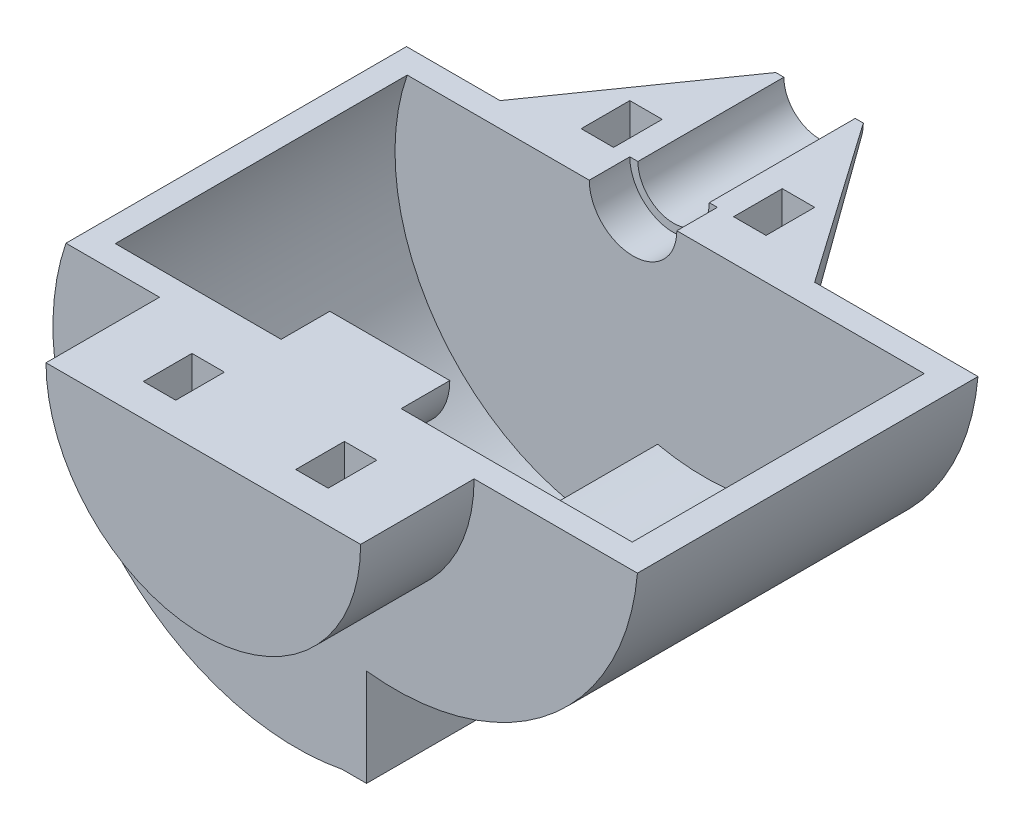
from build123d import *

# Parameters (mm, degrees)
SALIENTE_EXTRUIR1_DEPTH = 18
SALIENTE_EXTRUIR2_START = 1.5
CROQUIS2_R              = 2.7
SALIENTE_EXTRUIR2_DEPTH = 1.5
SALIENTE_EXTRUIR3_DEPTH = 1.5
CROQUIS6_W              = 5.4
CROQUIS6_H              = 1.803822617
SALIENTE_EXTRUIR7_DEPTH = 10
CROQUIS10_W             = 5.4
CROQUIS10_H             = 10
CORTAR_EXTRUIR3_DEPTH   = 10
CROQUIS12_W             = 50.345864286
CROQUIS12_H             = 43.398115734
CORTAR_EXTRUIR4_DEPTH   = 30
CROQUIS14_W             = 2
CROQUIS14_H             = 3
CORTAR_EXTRUIR5_DEPTH   = 30
CORTAR_EXTRUIR7_START   = -7.4
CROQUIS16_W             = 3
CROQUIS16_H             = 7.002646448
CROQUIS16_H_2           = 3.270183245
CORTAR_EXTRUIR7_DEPTH   = 7.4
CROQUIS17_W             = 3.7
CROQUIS17_H             = 3
REVOLUCI_N2_ANGLE       = 180
CROQUIS19_W             = 0.5
CROQUIS19_H             = 9
REVOLUCI_N3_ANGLE       = 180


with BuildPart() as part:
    # Croquis1 → Saliente-Extruir1 (new body)
    with BuildSketch(Plane.XY):
        with BuildLine():
            Line((-53.667784589, 33.4650382), (-54.417784589, 34.764076306))
            Line((-54.417784589, 34.764076306), (-59.613937012, 31.764076306))
            ThreePointArc((-59.613937012, 31.764076306), (-73.945502317, 40.827707086), (-87.584573208, 30.752047693))
            Line((-87.584573208, 30.752047693), (-88.334573208, 29.453009587))
            Line((-88.334573208, 29.453009587), (-83.138420786, 26.453009587))
            ThreePointArc((-83.138420786, 26.453009587), (-83.82197264, 9.509694567), (-68.276660199, 2.735742387))
            Line((-68.276660199, 2.735742387), (-66.776660199, 2.735742387))
            Line((-66.776660199, 2.735742387), (-66.776660199, 8.735742387))
            ThreePointArc((-66.776660199, 8.735742387), (-51.761543041, 16.615426627), (-53.667784589, 33.4650382))
        make_face()
        with BuildLine():
            Line((-54.507549641, 31.745180452), (-55.016343575, 32.626437397))
            Line((-55.016343575, 32.626437397), (-60.212495998, 29.626437397))
            ThreePointArc((-60.212495998, 29.626437397), (-72.508207296, 39.071771198), (-85.675250182, 30.884718699))
            Line((-85.675250182, 30.884718699), (-86.184044116, 30.003461754))
            Line((-86.184044116, 30.003461754), (-80.987891693, 27.003461754))
            ThreePointArc((-80.987891693, 27.003461754), (-83.019935064, 11.632396511), (-69.346218174, 4.322929129))
            Line((-69.346218174, 4.322929129), (-68.328630306, 4.322929129))
            Line((-68.328630306, 4.322929129), (-68.328630306, 10.322929129))
            ThreePointArc((-68.328630306, 10.322929129), (-54.000875637, 16.248660571), (-54.507549641, 31.745180452))
        make_face(mode=Mode.SUBTRACT)
    extrude(amount=SALIENTE_EXTRUIR1_DEPTH)

    # Croquis2 → Saliente-Extruir2 (add)
    with BuildSketch(Plane(origin=(0, 0, 0), x_dir=(-1, 0, 0), z_dir=(0, 0, -1)).offset(SALIENTE_EXTRUIR2_START)):
        with BuildLine():
            Line((87.584573208, 30.752047693), (88.334573208, 29.453009587))
            Line((88.334573208, 29.453009587), (83.138420786, 26.453009587))
            ThreePointArc((83.138420786, 26.453009587), (83.82197264, 9.509694567), (68.276660199, 2.735742387))
            Line((68.276660199, 2.735742387), (66.776660199, 2.735742387))
            Line((66.776660199, 2.735742387), (66.776660199, 8.735742387))
            ThreePointArc((66.776660199, 8.735742387), (51.761543041, 16.615426627), (53.667784589, 33.4650382))
            Line((53.667784589, 33.4650382), (54.417784589, 34.764076306))
            Line((54.417784589, 34.764076306), (59.613937012, 31.764076306))
            ThreePointArc((59.613937012, 31.764076306), (73.945502317, 40.827707086), (87.584573208, 30.752047693))
        make_face()
        with Locations((69.843005999, 22.317609427)):
            Circle(CROQUIS2_R, mode=Mode.SUBTRACT)
    extrude(amount=-SALIENTE_EXTRUIR2_DEPTH)

    # Croquis3 → Saliente-Extruir3 (add)
    with BuildSketch(Plane.XY.offset(18)):
        with BuildLine():
            Line((-66.776660199, 8.735742387), (-66.776660199, 2.735742387))
            Line((-66.776660199, 2.735742387), (-68.276660199, 2.735742387))
            ThreePointArc((-68.276660199, 2.735742387), (-83.82197264, 9.509694567), (-83.138420786, 26.453009587))
            Line((-83.138420786, 26.453009587), (-88.334573208, 29.453009587))
            Line((-88.334573208, 29.453009587), (-87.584573208, 30.752047693))
            ThreePointArc((-87.584573208, 30.752047693), (-73.945502317, 40.827707086), (-59.613937012, 31.764076306))
            Line((-59.613937012, 31.764076306), (-54.417784589, 34.764076306))
            Line((-54.417784589, 34.764076306), (-53.667784589, 33.4650382))
            ThreePointArc((-53.667784589, 33.4650382), (-51.761543041, 16.615426627), (-66.776660199, 8.735742387))
        make_face()
    extrude(amount=SALIENTE_EXTRUIR3_DEPTH)

    # Croquis6 → Saliente-Extruir7 (add)
    with BuildSketch(Plane(origin=(0, 0, -1.5), x_dir=(-1, 0, 0), z_dir=(0, 0, -1))):
        with Locations((69.843005999, 21.415698119)):
            Rectangle(CROQUIS6_W, CROQUIS6_H)
    extrude(amount=SALIENTE_EXTRUIR7_DEPTH)

    # Croquis10 → Cortar-Extruir3 (cut)
    with BuildSketch(Plane(origin=(0, 22.317609427, 0), x_dir=(1, 0, 0), z_dir=(0, 1, 0))):
        with Locations((-69.843005999, 6.5)):
            Rectangle(CROQUIS10_W, CROQUIS10_H)
    extrude(amount=-CORTAR_EXTRUIR3_DEPTH, mode=Mode.SUBTRACT)

    # Croquis11 → Revolución1 (revolve)
    with BuildSketch(Plane(origin=(0, 22.317609427, 0), x_dir=(1, 0, 0), z_dir=(0, 1, 0)), mode=Mode.PRIVATE) as revoluci_n1_sk:
        Polygon((-72.543005999, 1.5), (-79.543005999, 1.5), (-72.543005999, 11.5), align=None)
        Polygon((-71.193005999, -19.5), (-69.843005999, -19.5), (-69.843005999, -26.5), (-71.193005999, -26.5), (-79.543005999, -26.5), (-79.543005999, -19.5), align=None)
    revolve(revoluci_n1_sk.sketch.rotate(Axis((-69.843005999, 22.317609427, 19.5), (0, 0, 1)), 180), axis=Axis((-69.843005999, 22.317609427, 19.5), (0, 0, 1)))

    # Croquis12 → Cortar-Extruir4 (cut)
    with BuildSketch(Plane(origin=(0, 22.317609427, 0), x_dir=(1, 0, 0), z_dir=(0, 1, 0))):
        with Locations((-66.462924906, -7.850212976)):
            Rectangle(CROQUIS12_W, CROQUIS12_H)
    extrude(amount=CORTAR_EXTRUIR4_DEPTH, mode=Mode.SUBTRACT)

    # Croquis14 → Cortar-Extruir5 (cut)
    with BuildSketch(Plane(origin=(0, 22.317609427, 0), x_dir=(-1, 0, 0), z_dir=(0, 1, 0))):
        with Locations((65.143005999, -4)):
            Rectangle(CROQUIS14_W, CROQUIS14_H)
        with Locations((74.543005999, -4)):
            Rectangle(CROQUIS14_W, CROQUIS14_H)
        with Locations((74.543005999, 23)):
            Rectangle(CROQUIS14_W, CROQUIS14_H)
        with Locations((65.143005999, 23)):
            Rectangle(CROQUIS14_W, CROQUIS14_H)
    extrude(amount=-CORTAR_EXTRUIR5_DEPTH, mode=Mode.SUBTRACT)

    # Croquis16 → Cortar-Extruir7 (cut)
    with BuildSketch(Plane.ZY.offset(73.543005999).offset(CORTAR_EXTRUIR7_START)):
        with Locations((-4, 12.992198291)):
            Rectangle(CROQUIS16_W, CROQUIS16_H)
        with Locations((23, 12.478250621)):
            Rectangle(CROQUIS16_W, CROQUIS16_H_2)
    extrude(amount=CORTAR_EXTRUIR7_DEPTH, mode=Mode.SUBTRACT)

    # Croquis17 → Revolución2 (revolve)
    with BuildSketch(Plane(origin=(0, 22.317609427, 0), x_dir=(1, 0, 0), z_dir=(0, 1, 0))):
        with Locations((-67.993005999, -16.5)):
            Rectangle(CROQUIS17_W, CROQUIS17_H)
    revolve(axis=Axis((-69.843005999, 22.317609427, 15), (0, 0, -1)), revolution_arc=REVOLUCI_N2_ANGLE)

    # Croquis19 → Revolución3 (revolve)
    with BuildSketch(Plane(origin=(0, 22.317609427, 0), x_dir=(1, 0, 0), z_dir=(0, 1, 0))):
        with Locations((-67.393005999, 7)):
            Rectangle(CROQUIS19_W, CROQUIS19_H)
    revolve(axis=Axis((-69.843005999, 22.317609427, 0), (0, 0, -1)), revolution_arc=REVOLUCI_N3_ANGLE)


solid = part.part
